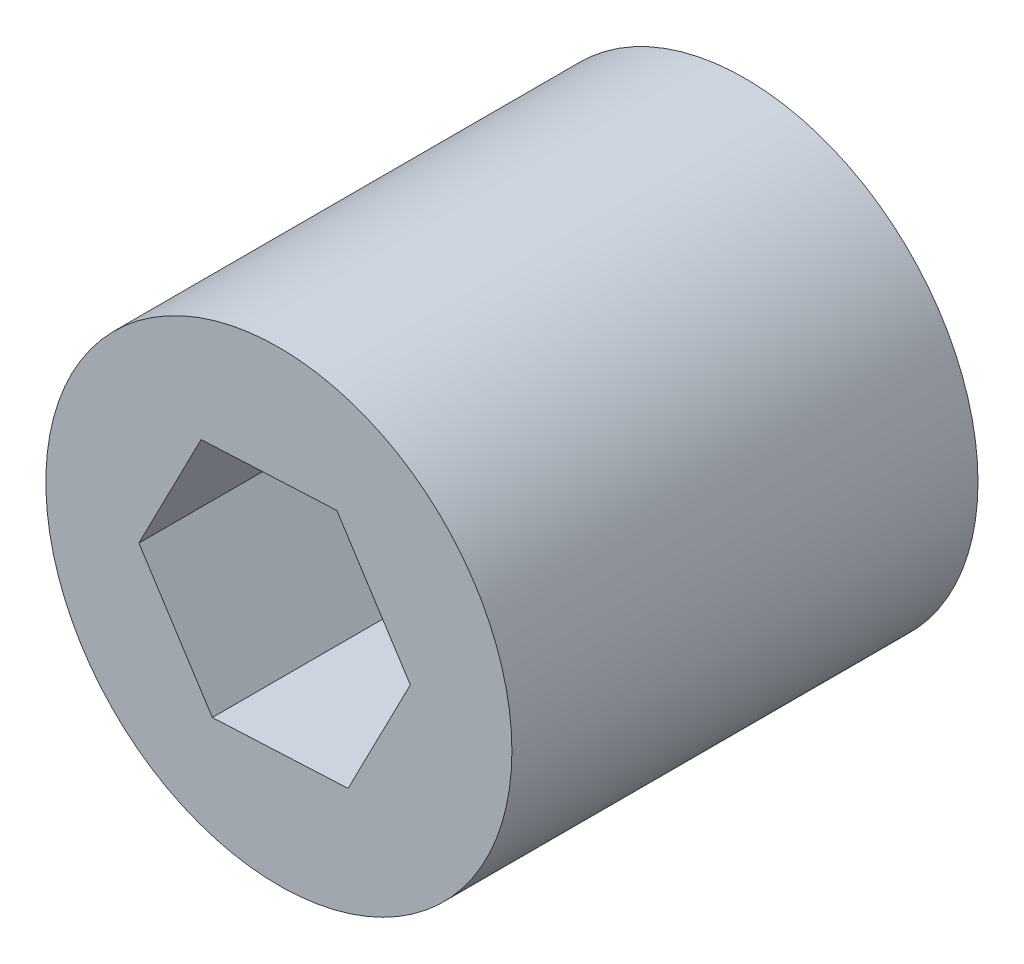
from build123d import *

# Parameters (mm, degrees)
SKETCH2_R           = 12.7
BOSS_EXTRUDE2_DEPTH = 25.4


with BuildPart() as part:
    # Sketch2 → Boss-Extrude2 (new body)
    with BuildSketch(Plane.XY):
        Circle(SKETCH2_R)
        Polygon((-3.626945327, -6.582238445), (3.770357687, -6.230266215), (7.164192301, 0.35197223), (3.160723902, 6.582238445), (-4.236579113, 6.230266215), (-7.630413727, -0.35197223), align=None, mode=Mode.SUBTRACT)
    extrude(amount=BOSS_EXTRUDE2_DEPTH)


solid = part.part
